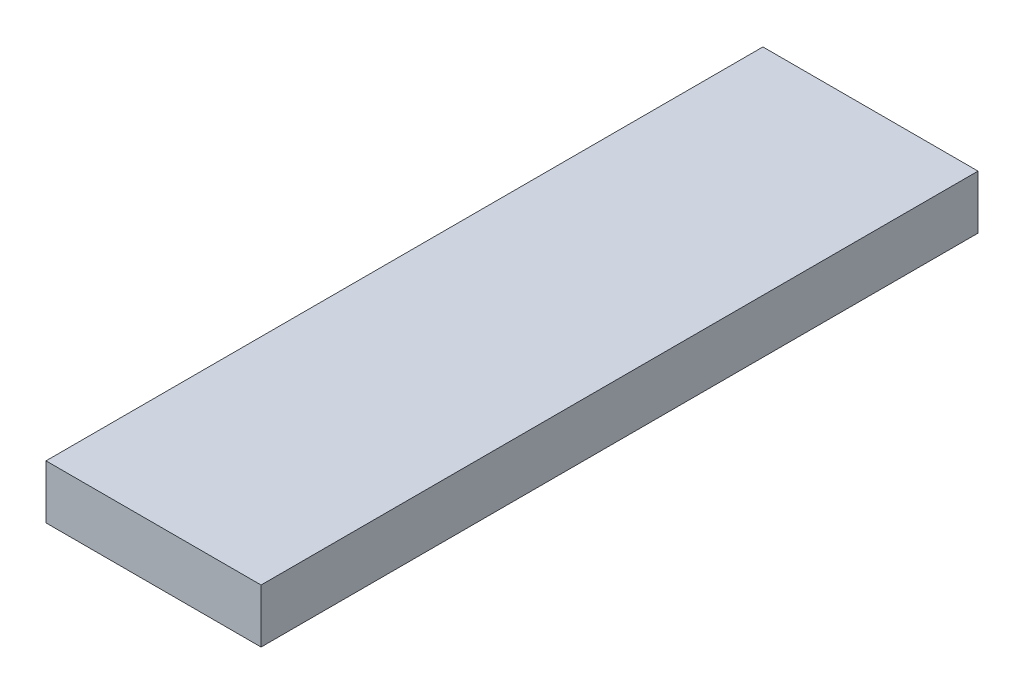
from build123d import *

# Parameters (mm, degrees)
SKETCH1_W           = 30
SKETCH1_H           = 100
BOSS_EXTRUDE1_DEPTH = 3.75
CUT_EXTRUDE1_DEPTH  = 6.5


with BuildPart() as part:
    # Sketch1 → Boss-Extrude1 (new, symmetric)
    with BuildSketch(Plane(origin=(0, 0, 0), x_dir=(1, 0, 0), z_dir=(0, 1, 0))):
        with Locations((15, 0)):
            Rectangle(SKETCH1_W, SKETCH1_H)
    extrude(amount=BOSS_EXTRUDE1_DEPTH, both=True)

    # Sketch2 → Cut-Extrude1 (cut)
    with BuildSketch(Plane(origin=(0, -3.25, 0), x_dir=(1, 0, 0), z_dir=(0, 1, 0))):
        Polygon((0, 25), (0, -25), (15, -25.261825974), (15, 25.261825974), align=None)
    extrude(amount=CUT_EXTRUDE1_DEPTH, mode=Mode.SUBTRACT)


solid = part.part
